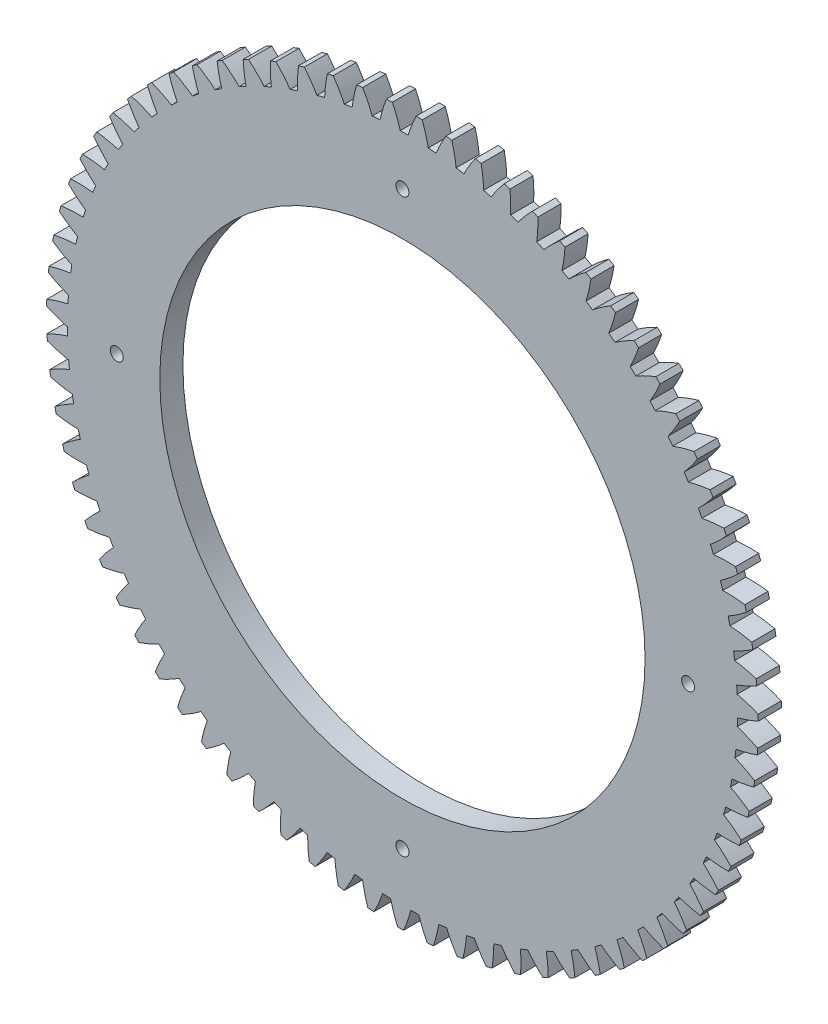
from build123d import *

# Parameters (mm, degrees)
SKETCH1_R           = 1.7859375
SKETCH1_R_2         = 66.675
BOSS_EXTRUDE1_DEPTH = 6.35


with BuildPart() as part:
    # Sketch1 → Boss-Extrude1 (new body)
    with BuildSketch(Plane.XY):
        with BuildLine():
            ThreePointArc((-97.77464665, 1.732793271), (-94.965729412, 0.569506405), (-92.073002114, -0.366111658))
            ThreePointArc((-92.073002114, -0.366111658), (-92.062340419, -1.448182518), (-92.038962327, -2.530053343))
            ThreePointArc((-92.038962327, -2.530053343), (-94.90083027, -3.556193809), (-97.671768724, -4.807254344))
            ThreePointArc((-97.671768724, -4.807254344), (-97.627726916, -5.631255378), (-97.576733606, -6.454855443))
            ThreePointArc((-97.576733606, -6.454855443), (-94.6803263, -7.379018362), (-91.719453703, -8.069297899))
            ThreePointArc((-91.719453703, -8.069297899), (-91.618284044, -9.146681636), (-91.504459324, -10.22280196))
            ThreePointArc((-91.504459324, -10.22280196), (-94.270425073, -11.484818544), (-96.926959408, -12.963357588))
            ThreePointArc((-96.926959408, -12.963357588), (-96.814121432, -13.780783411), (-96.694389885, -14.597227984))
            ThreePointArc((-96.694389885, -14.597227984), (-93.730808727, -15.275784617), (-90.722559224, -15.715883813))
            ThreePointArc((-90.722559224, -15.715883813), (-90.531591233, -16.781023355), (-90.328118285, -17.843844966))
            ThreePointArc((-90.328118285, -17.843844966), (-92.978780576, -19.332885529), (-95.502277113, -21.028532192))
            ThreePointArc((-95.502277113, -21.028532192), (-95.321434446, -21.833649149), (-95.133804493, -22.637211459))
            ThreePointArc((-95.133804493, -22.637211459), (-92.123836877, -23.065402218), (-89.089311176, -23.252234094))
            ThreePointArc((-89.089311176, -23.252234094), (-88.809884357, -24.297658252), (-88.518190397, -25.339726221))
            ThreePointArc((-88.518190397, -25.339726221), (-91.03495674, -27.045346212), (-93.407714963, -28.946206752))
            ThreePointArc((-93.407714963, -28.946206752), (-93.160136086, -29.733367526), (-92.905923817, -30.51841116))
            ThreePointArc((-92.905923817, -30.51841116), (-89.870682501, -30.693232595), (-86.83116562, -30.625486659))
            ThreePointArc((-86.83116562, -30.625486659), (-86.465239952, -31.643862534), (-86.087371004, -32.657867503))
            ThreePointArc((-86.087371004, -32.657867503), (-88.45258809, -34.568103224), (-90.657964806, -36.660844469))
            ThreePointArc((-90.657964806, -36.660844469), (-90.345386307, -37.424527694), (-90.026374838, -38.185546135))
            ThreePointArc((-90.026374838, -38.185546135), (-86.98714986, -38.105771999), (-83.963961826, -37.78392344))
            ThreePointArc((-83.963961826, -37.78392344), (-83.514104014, -38.768107857), (-83.052710556, -39.746937308))
            ThreePointArc((-83.052710556, -39.746937308), (-85.249788088, -41.848389829), (-87.272314163, -44.118332704))
            ThreePointArc((-87.272314163, -44.118332704), (-86.896928556, -44.853181689), (-86.515355523, -45.584836939))
            ThreePointArc((-86.515355523, -45.584836939), (-83.493464862, -45.251026791), (-80.507811168, -44.677333146))
            ThreePointArc((-80.507811168, -44.677333146), (-79.977176641, -45.620422758), (-79.435495017, -46.557210907))
            ThreePointArc((-79.435495017, -46.557210907), (-81.449022074, -48.835140048), (-83.274510942, -51.266362533))
            ThreePointArc((-83.274510942, -51.266362533), (-82.838951286, -51.967222841), (-82.39749315, -52.664382865))
            ThreePointArc((-82.39749315, -52.664382865), (-79.414133199, -52.078878143), (-76.48695606, -51.25736346))
            ThreePointArc((-76.48695606, -51.25736346), (-75.879266838, -52.152743171), (-75.261096556, -53.040919122))
            ThreePointArc((-75.261096556, -53.040919122), (-77.076949692, -55.479346847), (-78.692596859, -58.054795664))
            ThreePointArc((-78.692596859, -58.054795664), (-78.199918293, -58.716751264), (-77.701671566, -59.374525985))
            ThreePointArc((-77.701671566, -59.374525985), (-74.77776845, -58.541433583), (-71.92959991, -57.477860198))
            ThreePointArc((-71.92959991, -57.477860198), (-71.249118496, -58.319249563), (-70.558795576, -59.1525834))
            ThreePointArc((-70.558795576, -59.1525834), (-72.164237887, -61.73440589), (-73.558710749, -64.436016116))
            ThreePointArc((-73.558710749, -64.436016116), (-73.01236906, -65.054423864), (-72.460828583, -65.668199465))
            ThreePointArc((-72.460828583, -65.668199465), (-69.616891383, -64.593362929), (-66.867709298, -63.295191044))
            ThreePointArc((-66.867709298, -63.295191044), (-66.119208781, -64.076688322), (-65.361575343, -64.849334806))
            ThreePointArc((-65.361575343, -64.849334806), (-66.745345803, -67.556442431), (-67.908863136, -70.365264212))
            ThreePointArc((-67.908863136, -70.365264212), (-67.312690517, -70.935786423), (-66.711724952, -71.501257709))
            ThreePointArc((-66.711724952, -71.501257709), (-63.967701843, -70.192216244), (-61.33678975, -68.668551603))
            ThreePointArc((-61.33678975, -68.668551603), (-60.525520323, -69.38467515), (-59.70589062, -70.091214723))
            ThreePointArc((-59.70589062, -70.091214723), (-60.858283075, -72.904619068), (-61.78268364, -75.800950537))
            ThreePointArc((-61.78268364, -75.800950537), (-61.140861814, -76.319585407), (-60.494686502, -76.832786003))
            ThreePointArc((-60.494686502, -76.832786003), (-57.869824835, -75.298721595), (-55.375636692, -73.560251611))
            ThreePointArc((-55.375636692, -73.560251611), (-54.507288827, -74.205978336), (-53.631411974, -74.841455129))
            ThreePointArc((-53.631411974, -74.841455129), (-54.544343218, -77.741422184), (-55.223143009, -80.704947656))
            ThreePointArc((-55.223143009, -80.704947656), (-54.540173895, -81.168057335), (-53.853321292, -81.625387508))
            ThreePointArc((-53.853321292, -81.625387508), (-51.366032585, -79.877060517), (-49.02606333, -77.935979306))
            ThreePointArc((-49.02606333, -77.935979306), (-48.106727864, -78.5067799), (-47.180747506, -79.066736501))
            ThreePointArc((-47.180747506, -79.066736501), (-47.847813983, -82.032925081), (-48.276251708, -85.042857555))
            ThreePointArc((-48.276251708, -85.042857555), (-47.556925843, -85.44719366), (-46.834213727, -85.845445567))
            ThreePointArc((-46.834213727, -85.845445567), (-44.501944523, -83.89511925), (-42.33260736, -81.765042104))
            ThreePointArc((-42.33260736, -81.765042104), (-41.368732769, -82.256912811), (-40.399143994, -82.737421525))
            ThreePointArc((-40.399143994, -82.737421525), (-40.815666712, -85.749025949), (-40.990737187, -88.78425291))
            ThreePointArc((-40.990737187, -88.78425291), (-40.240100126, -89.126979315), (-39.486597802, -89.463359505))
            ThreePointArc((-39.486597802, -89.463359505), (-37.325707295, -87.324714), (-35.342218564, -85.020581879))
            ThreePointArc((-35.342218564, -85.020581879), (-34.340565738, -85.430072579), (-33.334169514, -85.827762985))
            ThreePointArc((-33.334169514, -85.827762985), (-33.497226865, -88.86365901), (-33.417702097, -91.902890523))
            ThreePointArc((-33.417702097, -91.902890523), (-32.64101902, -92.181603248), (-31.862011765, -92.453752256))
            ThreePointArc((-31.862011765, -92.453752256), (-29.887657049, -90.141788625), (-28.103929499, -87.67976336))
            ThreePointArc((-28.103929499, -87.67976336), (-27.071524311, -88.00400177), (-26.035379785, -88.316084354))
            ThreePointArc((-26.035379785, -88.316084354), (-25.943828039, -91.354977352), (-25.610265837, -94.376895392))
            ThreePointArc((-25.610265837, -94.376895392), (-24.812984617, -94.589639466), (-24.013936609, -94.795648363))
            ThreePointArc((-24.013936609, -94.795648363), (-22.239966363, -92.326583369), (-20.66851156, -89.723934298))
            ThreePointArc((-20.66851156, -89.723934298), (-19.612595592, -89.96064612), (-18.553970573, -90.184931846))
            ThreePointArc((-18.553970573, -90.184931846), (-18.2084519, -93.205506167), (-17.623191963, -96.188914148))
            ThreePointArc((-17.623191963, -96.188914148), (-16.810904955, -96.334197327), (-15.997420941, -96.472621107))
            ThreePointArc((-15.997420941, -96.472621107), (-14.436278292, -93.863773467), (-13.088118864, -91.138756304))
            ThreePointArc((-13.088118864, -91.138756304), (-12.016098607, -91.286281173), (-10.942418589, -91.421196839))
            ThreePointArc((-10.942418589, -91.421196839), (-10.345356553, -94.402265323), (-9.51250406, -97.326236784))
            ThreePointArc((-9.51250406, -97.326236784), (-8.690908874, -97.403040009), (-7.868694859, -97.472907729))
            ThreePointArc((-7.868694859, -97.472907729), (-6.531330101, -94.742576635), (-5.415922417, -91.914305418))
            ThreePointArc((-5.415922417, -91.914305418), (-4.335317323, -91.971608553), (-3.254113401, -92.016207823))
            ThreePointArc((-3.254113401, -92.016207823), (-2.409695964, -94.936860416), (-1.335092776, -97.780885797))
            ThreePointArc((-1.335092776, -97.780885797), (-0.509952312, -97.788670349), (0.315224464, -97.789491938))
            ThreePointArc((0.315224464, -97.789491938), (1.419430677, -94.956828701), (2.294262834, -92.045141719))
            ThreePointArc((2.294262834, -92.045141719), (3.375873096, -92.01182118), (4.457017055, -91.965791222))
            ThreePointArc((4.457017055, -91.965791222), (5.542866911, -94.805541646), (6.851683225, -97.549672152))
            ThreePointArc((6.851683225, -97.549672152), (7.6745812, -97.488383428), (8.496932713, -97.420153123))
            ThreePointArc((8.496932713, -97.420153123), (9.360235169, -94.505026839), (9.988355479, -91.530347486))
            ThreePointArc((9.988355479, -91.530347486), (11.063384191, -91.406636993), (12.136884739, -91.270300673))
            ThreePointArc((12.136884739, -91.270300673), (13.456550558, -94.009230118), (14.990399591, -96.634217646))
            ThreePointArc((14.990399591, -96.634217646), (15.805283039, -96.504285542), (16.619041084, -96.36748193))
            ThreePointArc((16.619041084, -96.36748193), (17.235384337, -93.390340117), (17.612386988, -90.37353363))
            ThreePointArc((17.612386988, -90.37353363), (18.673293596, -90.160300922), (19.731620897, -89.934614542))
            ThreePointArc((19.731620897, -89.934614542), (21.275846171, -92.553511387), (23.023969075, -95.040943535))
            ThreePointArc((23.023969075, -95.040943535), (23.825122173, -94.843279432), (24.624578823, -94.63886209))
            ThreePointArc((24.624578823, -94.63886209), (24.989639667, -91.620587259), (25.112880256, -88.582814368))
            ThreePointArc((25.112880256, -88.582814368), (26.152223262, -88.281555121), (27.187953911, -87.968101709))
            ThreePointArc((27.187953911, -87.968101709), (28.945907009, -90.448596273), (30.896041958, -92.781025492))
            ThreePointArc((30.896041958, -92.781025492), (31.677845194, -92.517015861), (32.457392835, -92.246418632))
            ThreePointArc((32.457392835, -92.246418632), (32.56861063, -89.208181811), (32.437224713, -86.17075031))
            ThreePointArc((32.437224713, -86.17075031), (33.447713873, -85.78357764), (34.453582963, -85.384555847))
            ThreePointArc((34.453582963, -85.384555847), (36.412933108, -87.709249243), (38.551401305, -89.870315218))
            ThreePointArc((38.551401305, -89.870315218), (39.308370891, -89.541811898), (40.062541556, -89.206932825))
            ThreePointArc((40.062541556, -89.206932825), (39.91913619, -86.170045063), (39.534045345, -83.154260353))
            ThreePointArc((39.534045345, -83.154260353), (40.508592803, -82.683889998), (41.477544885, -82.202098674))
            ThreePointArc((41.477544885, -82.202098674), (43.624548643, -84.354684849), (45.936350272, -86.329229255))
            ThreePointArc((45.936350272, -86.329229255), (46.663176609, -85.938536459), (47.386680333, -85.54172448))
            ThreePointArc((47.386680333, -85.54172448), (46.989657692, -82.527487362), (46.353563054, -79.554503005))
            ThreePointArc((46.353563054, -79.554503005), (47.28533306, -79.004234276), (48.210571632, -78.443052841))
            ThreePointArc((48.210571632, -78.443052841), (50.530169314, -80.40843295), (52.999088746, -82.182605776))
            ThreePointArc((52.999088746, -82.182605776), (53.690673671, -81.732463934), (54.378435595, -81.276502399))
            ThreePointArc((54.378435595, -81.276502399), (53.730580507, -78.306058634), (52.847943822, -75.396727978))
            ThreePointArc((52.847943822, -75.396727978), (53.730400679, -74.770420615), (54.605435857, -74.133785354))
            ThreePointArc((54.605435857, -74.133785354), (57.081357153, -75.898173667), (59.690076693, -77.459530365))
            ThreePointArc((59.690076693, -77.459530365), (60.341569234, -76.9530969), (60.988765202, -76.441184051))
            ThreePointArc((60.988765202, -76.441184051), (60.094621904, -73.535369167), (58.971634237, -70.710099078))
            ThreePointArc((58.971634237, -70.710099078), (59.798588144, -70.012146176), (60.617282185, -69.304522628))
            ThreePointArc((60.617282185, -69.304522628), (63.232160285, -70.855543228), (65.962381639, -72.193132003))
            ThreePointArc((65.962381639, -72.193132003), (66.569212043, -71.633959181), (67.171302441, -71.06968572))
            ThreePointArc((67.171302441, -71.06968572), (66.037142708, -68.24888192), (64.681681008, -65.527489637))
            ThreePointArc((64.681681008, -65.527489637), (65.447331478, -64.762786835), (66.203941831, -63.98913847))
            ThreePointArc((66.203941831, -63.98913847), (68.939435244, -65.315912063), (71.772007872, -66.420350692))
            ThreePointArc((71.772007872, -66.420350692), (72.329919661, -65.812360707), (72.882681256, -65.199684607))
            ThreePointArc((72.882681256, -65.199684607), (71.516460402, -62.483677804), (69.93803226, -59.885251938))
            ThreePointArc((69.93803226, -59.885251938), (70.637008805, -59.059163076), (71.326228392, -58.224916483))
            ThreePointArc((71.326228392, -58.224916483), (74.163149598, -59.318136704), (77.078205038, -60.181678343))
            ThreePointArc((77.078205038, -60.181678343), (77.583284861, -59.52913581), (78.082840429, -58.872354553))
            ThreePointArc((78.082840429, -58.872354553), (76.494141512, -56.280195582), (74.703818467, -53.822962224))
            ThreePointArc((74.703818467, -53.822962224), (75.331218268, -52.941281722), (75.94821271, -52.052288541))
            ThreePointArc((75.94821271, -52.052288541), (78.866662744, -52.904287237), (81.843753976, -53.520874761))
            ThreePointArc((81.843753976, -53.520874761), (82.292459061, -52.828356796), (82.735304578, -52.13207723))
            ThreePointArc((82.735304578, -52.13207723), (80.935271179, -49.681948225), (78.945611062, -47.383143102))
            ThreePointArc((78.945611062, -47.383143102), (79.49703336, -46.452055315), (80.037474884, -45.514551194))
            ThreePointArc((80.037474884, -45.514551194), (83.016982916, -46.119352206), (86.035227784, -46.484660697))
            ThreePointArc((86.035227784, -46.484660697), (86.424410788, -45.757024816), (86.807440011, -45.026130843))
            ThreePointArc((86.807440011, -45.026130843), (84.808698072, -42.735217698), (82.633656917, -40.610965276))
            ThreePointArc((82.633656917, -40.610965276), (83.105233882, -39.637001116), (83.565331678, -38.657561973))
            ThreePointArc((83.565331678, -38.657561973), (86.584998601, -39.010923056), (89.623226286, -39.122390138))
            ThreePointArc((89.623226286, -39.122390138), (89.950157369, -38.364740184), (90.270683623, -37.6043585))
            ThreePointArc((90.270683623, -37.6043585), (88.087252882, -35.488730324), (85.742087041, -33.553930707))
            ThreePointArc((85.742087041, -33.553930707), (86.130510899, -32.543921834), (86.507037712, -31.52941773))
            ThreePointArc((86.507037712, -31.52941773), (89.545682731, -31.62886031), (92.58258225, -31.485704121))
            ThreePointArc((92.58258225, -31.485704121), (92.844968225, -30.703354464), (93.100743249, -29.9188186))
            ThreePointArc((93.100743249, -29.9188186), (90.747938904, -27.993315006), (88.249098031, -26.261539423))
            ThreePointArc((88.249098031, -26.261539423), (88.551644267, -25.222570322), (88.841959032, -24.180117275))
            ThreePointArc((88.841959032, -24.180117275), (91.878268236, -24.024943835), (94.892537919, -23.628168512))
            ThreePointArc((94.892537919, -23.628168512), (95.088538338, -22.826606773), (95.277768054, -22.023419684))
            ThreePointArc((95.277768054, -22.023419684), (92.772093337, -20.301546696), (90.137105004, -18.784942309))
            ThreePointArc((90.137105004, -18.784942309), (90.351651475, -17.724300602), (90.553717842, -16.661210671))
            ThreePointArc((90.553717842, -16.661210671), (93.566393704, -16.25250964), (96.536890616, -15.604898278))
            ThreePointArc((96.536890616, -15.604898278), (96.665130675, -14.789746837), (96.786487773, -13.973542303))
            ThreePointArc((96.786487773, -13.973542303), (94.145518192, -12.467377622), (91.39286495, -11.176582321))
            ThreePointArc((91.39286495, -11.176582321), (91.517906765, -10.101707648), (91.630307385, -9.025437645))
            ThreePointArc((91.630307385, -9.025437645), (94.598218147, -8.366075767), (97.504106386, -7.472170895))
            ThreePointArc((97.504106386, -7.472170895), (97.563686575, -6.649147452), (97.616319822, -5.825650563))
            ThreePointArc((97.616319822, -5.825650563), (94.85857988, -4.545758852), (92.007569613, -3.489826639))
            ThreePointArc((92.007569613, -3.489826639), (92.042229695, -2.408258473), (92.064176157, -1.326357659))
            ThreePointArc((92.064176157, -1.326357659), (94.966504059, -0.420959885), (97.787400907, 0.712968399))
            ThreePointArc((97.787400907, 0.712968399), (97.777903313, 1.538090924), (97.761443524, 2.36310393))
            ThreePointArc((97.761443524, 2.36310393), (94.906276786, 3.40774515), (91.976907283, 4.22140767))
            ThreePointArc((91.976907283, 4.22140767), (91.920942516, 5.302082905), (91.852280882, 6.382025773))
            ThreePointArc((91.852280882, 6.382025773), (94.668668178, 7.527108729), (97.38478707, 8.893106731))
            ThreePointArc((97.38478707, 8.893106731), (97.306278313, 9.714540697), (97.220840941, 10.535282947))
            ThreePointArc((97.220840941, 10.535282947), (94.28827435, 11.337346268), (91.301093034, 11.903031837))
            ThreePointArc((91.301093034, 11.903031837), (91.15489597, 12.97523398), (90.996107852, 14.045643879))
            ThreePointArc((90.996107852, 14.045643879), (93.706799609, 15.422380084), (96.299088923, 17.01086631))
            ThreePointArc((96.299088923, 17.01086631), (96.152119684, 17.822849948), (95.998304012, 18.633564524))
            ThreePointArc((95.998304012, 18.633564524), (93.008907416, 19.187424048), (89.984867217, 19.501164788))
            ThreePointArc((89.984867217, 19.501164788), (89.749463323, 20.557373113), (89.501662506, 21.610741886))
            ThreePointArc((89.501662506, 21.610741886), (92.087645169, 23.209474523), (94.537921858, 25.009306883))
            ThreePointArc((94.537921858, 25.009306883), (94.323523021, 25.806144711), (94.102407955, 26.601145034))
            ThreePointArc((94.102407955, 26.601145034), (91.077149823, 26.902915835), (88.03746221, 26.96251108))
            ThreePointArc((88.03746221, 26.96251108), (87.714502677, 27.995317043), (87.379427304, 29.024256065))
            ThreePointArc((87.379427304, 29.024256065), (89.822562063, 30.833771174), (92.113639197, 32.832325138))
            ThreePointArc((92.113639197, 32.832325138), (91.833314616, 33.608427911), (91.546451119, 34.382137624))
            ThreePointArc((91.546451119, 34.382137624), (88.506551463, 34.429702996), (85.472537661, 34.234734728))
            ThreePointArc((85.472537661, 34.234734728), (85.064287816, 35.236893938), (84.644288202, 36.234185943))
            ThreePointArc((84.644288202, 36.234185943), (86.927438221, 38.241791075), (89.04324554, 40.425048222))
            ThreePointArc((89.04324554, 40.425048222), (88.69896149, 41.174972137), (88.348361704, 41.921964222))
            ThreePointArc((88.348361704, 41.921964222), (85.315143237, 41.714990529), (82.308084672, 41.266826311))
            ThreePointArc((82.308084672, 41.266826311), (81.817408096, 42.231309341), (81.315430235, 43.18995904))
            ThreePointArc((81.315430235, 43.18995904), (83.422580858, 45.381572288), (85.348277493, 47.734218638))
            ThreePointArc((85.348277493, 47.734218638), (84.94244888, 48.452703518), (84.53057201, 49.167738362))
            ThreePointArc((84.53057201, 49.167738362), (81.525310579, 48.707677376), (78.566299607, 48.009460757))
            ThreePointArc((78.566299607, 48.009460757), (77.996638043, 48.929502451), (77.41620295, 49.842785606))
            ThreePointArc((77.41620295, 49.842785606), (79.332574029, 52.203034378), (81.054652602, 54.708567808))
            ThreePointArc((81.054652602, 54.708567808), (80.590126022, 55.390573997), (80.119861088, 56.068636145))
            ThreePointArc((80.119861088, 56.068636145), (77.163636444, 55.358714862), (74.273428401, 54.41534333))
            ThreePointArc((74.273428401, 54.41534333), (73.628777615, 55.284490258), (72.973956624, 56.146000843))
            ThreePointArc((72.973956624, 56.146000843), (74.686106194, 58.658329689), (76.192487561, 61.299175682))
            ThreePointArc((76.192487561, 61.299175682), (75.672521334, 61.939919397), (75.147166907, 62.57625273))
            ThreePointArc((75.147166907, 62.57625273), (72.260714841, 61.621450738), (69.459582459, 60.439541368))
            ThreePointArc((69.459582459, 60.439541368), (68.744464214, 61.251697087), (68.019850425, 62.055392226))
            ThreePointArc((68.019850425, 62.055392226), (69.515768985, 64.702178964), (70.795886964, 67.459813882))
            ThreePointArc((70.795886964, 67.459813882), (70.22412828, 68.054800766), (69.647369344, 68.644941864))
            ThreePointArc((69.647369344, 68.644941864), (66.850936242, 67.451956413), (64.158527453, 66.039799448))
            ThreePointArc((64.158527453, 66.039799448), (63.377957789, 66.789267271), (62.588633847, 67.529509618))
            ThreePointArc((62.588633847, 67.529509618), (63.857828605, 70.292188942), (64.902704086, 73.147269958))
            ThreePointArc((64.902704086, 73.147269958), (64.283163421, 73.692326606), (63.659045526, 74.232136051))
            ThreePointArc((63.659045526, 74.232136051), (60.972246358, 72.809335077), (58.407446475, 71.176835785))
            ThreePointArc((58.407446475, 71.176835785), (57.566900528, 71.858358733), (56.718402973, 72.52995602))
            ThreePointArc((56.718402973, 72.52995602), (57.751971438, 75.389149719), (58.554275372, 78.321650491))
            ThreePointArc((58.554275372, 78.321650491), (57.891298359, 78.812953722), (57.224199242, 79.29864514))
            ThreePointArc((57.224199242, 79.29864514), (54.665879975, 77.656008569), (52.246679226, 75.814617759))
            ThreePointArc((52.246679226, 75.814617759), (51.352052821, 76.423415438), (50.450333254, 77.021656894))
            ThreePointArc((50.450333254, 77.021656894), (51.241025686, 79.957309778), (51.795130488, 82.94666092))
            ThreePointArc((51.795130488, 82.94666092), (51.093367433, 83.380764594), (50.387966317, 83.808931209))
            ThreePointArc((50.387966317, 83.808931209), (47.97607172, 81.957980957), (45.719439061, 79.920614663))
            ThreePointArc((45.719439061, 79.920614663), (44.77700736, 80.452416794), (43.828390695, 80.973106185))
            ThreePointArc((43.828390695, 80.973106185), (44.370660956, 83.964626758), (44.672679978, 86.98986012))
            ThreePointArc((44.672679978, 86.98986012), (43.937053246, 87.363719312), (43.198298011, 87.731357843))
            ThreePointArc((43.198298011, 87.731357843), (40.949745794, 85.685076996), (38.87150988, 83.466025877))
            ThreePointArc((38.87150988, 83.466025877), (37.887883364, 83.917102251), (36.899023467, 84.356587314))
            ThreePointArc((36.899023467, 84.356587314), (37.18906792, 87.38299221), (37.236882715, 90.422887953))
            ThreePointArc((37.236882715, 90.422887953), (36.472552198, 90.73388031), (35.705624683, 91.038412036))
            ThreePointArc((35.705624683, 91.038412036), (33.636186823, 88.811153783), (31.750924987, 86.42598289))
            ThreePointArc((31.750924987, 86.42598289), (30.73300309, 86.793169531), (29.710836101, 87.148367594))
            ThreePointArc((29.710836101, 87.148367594), (29.746620292, 90.188428756), (29.539895474, 93.221664195))
            ThreePointArc((29.539895474, 93.221664195), (28.752222402, 93.46760833), (27.962502052, 93.706897179))
            ThreePointArc((27.962502052, 93.706897179), (26.086694169, 91.314284138), (24.407630168, 88.779723731))
            ThreePointArc((24.407630168, 88.779723731), (23.36255288, 89.060445087), (22.314248566, 89.328864691))
            ThreePointArc((22.314248566, 89.328864691), (22.095521496, 92.361258275), (21.635707091, 95.366557444))
            ThreePointArc((21.635707091, 95.366557444), (20.830216425, 95.545728234), (20.02324256, 95.718095768))
            ThreePointArc((20.02324256, 95.718095768), (18.354222099, 93.176910399), (16.89313336, 90.510738597))
            ThreePointArc((16.89313336, 90.510738597), (15.828231148, 90.70302561), (14.761142611, 90.882783985))
            ThreePointArc((14.761142611, 90.882783985), (14.289438492, 93.886239929), (13.579759768, 96.842522812))
            ThreePointArc((13.579759768, 96.842522812), (12.762101446, 96.953663503), (11.943534409, 97.057900687))
            ThreePointArc((11.943534409, 97.057900687), (10.493008348, 94.385967581), (9.26014336, 91.606885664))
            ThreePointArc((9.26014336, 91.606885664), (8.182885746, 91.709389579), (7.104497846, 91.799225849))
            ThreePointArc((7.104497846, 91.799225849), (6.383125344, 94.752677066), (5.428560188, 97.639207464))
            ThreePointArc((5.428560188, 97.639207464), (4.604469495, 97.681538484), (3.780050945, 97.71691417))
            ThreePointArc((3.780050945, 97.71691417), (2.558193683, 94.932975016), (1.562200107, 92.060476248))
            ThreePointArc((1.562200107, 92.060476248), (0.480143281, 92.072478073), (-0.601979866, 92.071762101))
            ThreePointArc((-0.601979866, 92.071762101), (-1.567960842, 94.954492254), (-2.760716842, 97.75102323))
            ThreePointArc((-2.760716842, 97.75102323), (-3.585459501, 97.724247657), (-4.409946861, 97.690513709))
            ThreePointArc((-4.409946861, 97.690513709), (-5.394564873, 94.814095841), (-6.146700858, 91.868328736))
            ThreePointArc((-6.146700858, 91.868328736), (-7.225967045, 91.789744288), (-8.304235122, 91.698481095))
            ThreePointArc((-8.304235122, 91.698481095), (-9.508048909, 94.490269903), (-10.930629427, 97.177185802))
            ThreePointArc((-10.930629427, 97.177185802), (-11.750239076, 97.081491447), (-12.569012058, 96.978884485))
            ThreePointArc((-12.569012058, 96.978884485), (-13.309484432, 94.030163908), (-13.812487132, 91.031790905))
            ThreePointArc((-13.812487132, 91.031790905), (-14.881392403, 90.863171397), (-15.948242136, 90.68200113))
            ThreePointArc((-15.948242136, 90.68200113), (-17.381444844, 93.3632662), (-19.0238715, 95.921720237))
            ThreePointArc((-19.0238715, 95.921720237), (-19.832599165, 95.757778328), (-20.639914666, 95.587018065))
            ThreePointArc((-20.639914666, 95.587018065), (-21.131047521, 92.586677935), (-21.381388733, 89.556730467))
            ThreePointArc((-21.381388733, 89.556730467), (-22.432435486, 89.299258643), (-23.48038369, 89.029452081))
            ThreePointArc((-23.48038369, 89.029452081), (-25.132922433, 91.581386266), (-26.983674783, 93.993432724))
            ThreePointArc((-26.983674783, 93.993432724), (-27.775847821, 93.762393196), (-28.566043102, 93.524677393))
            ThreePointArc((-28.566043102, 93.524677393), (-28.804391494, 90.49376294), (-28.800315254, 87.453493912))
            ThreePointArc((-28.800315254, 87.453493912), (-29.826131152, 87.108975752), (-30.847827222, 86.752425394))
            ThreePointArc((-30.847827222, 86.752425394), (-32.708110629, 89.157128708), (-34.754206976, 91.405848814))
            ThreePointArc((-34.754206976, 91.405848814), (-35.524268862, 91.109332243), (-36.291801271, 90.806328306))
            ThreePointArc((-36.291801271, 90.806328306), (-36.275693357, 87.766099217), (-36.017228258, 84.736833932))
            ThreePointArc((-36.017228258, 84.736833932), (-37.010617938, 84.307685984), (-37.998895411, 83.866892774))
            ThreePointArc((-37.998895411, 83.866892774), (-40.053874929, 86.107497952), (-42.280963377, 88.177118551))
            ThreePointArc((-42.280963377, 88.177118551), (-43.02351268, 87.817204787), (-43.76299853, 87.451038071))
            ThreePointArc((-43.76299853, 87.451038071), (-43.492547294, 84.422819369), (-42.981506283, 81.425805945))
            ThreePointArc((-42.981506283, 81.425805945), (-43.935501831, 80.915038373), (-44.883428651, 80.39309416))
            ThreePointArc((-44.883428651, 80.39309416), (-47.118690075, 82.453884966), (-49.511149199, 84.329889156))
            ThreePointArc((-49.511149199, 84.329889156), (-50.22097747, 83.909102736), (-50.927229797, 83.482341637))
            ThreePointArc((-50.927229797, 83.482341637), (-50.404332262, 80.4873741), (-49.644299924, 77.543634434))
            ThreePointArc((-49.644299924, 77.543634434), (-50.552209746, 76.954829906), (-51.453136887, 76.355395753))
            ThreePointArc((-51.453136887, 76.355395753), (-53.853001465, 78.22191722), (-56.394049883, 79.891146179))
            ThreePointArc((-56.394049883, 79.891146179), (-57.066178186, 79.412438618), (-57.734243139, 78.928076558))
            ThreePointArc((-57.734243139, 78.928076558), (-56.962567055, 75.987367732), (-55.95887447, 73.117550042))
            ThreePointArc((-55.95887447, 73.117550042), (-56.814330232, 72.454838599), (-57.661938338, 71.782119105))
            ThreePointArc((-57.661938338, 71.782119105), (-60.209572744, 73.441278926), (-62.881386826, 74.892024214))
            ThreePointArc((-62.881386826, 74.892024214), (-63.511100664, 74.3587533), (-64.136292247, 73.820187733))
            ThreePointArc((-64.136292247, 73.820187733), (-63.121250367, 70.954364577), (-61.880937718, 68.178598572))
            ThreePointArc((-61.880937718, 68.178598572), (-62.677939012, 67.446628658), (-63.466282721, 66.705342468))
            ThreePointArc((-63.466282721, 66.705342468), (-66.14381713, 68.145502829), (-68.927656021, 69.367588508))
            ThreePointArc((-68.927656021, 69.367588508), (-69.510538404, 68.783494755), (-70.088471346, 68.194503329))
            ThreePointArc((-70.088471346, 68.194503329), (-68.83718346, 65.423667534), (-67.36895065, 62.761423219))
            ThreePointArc((-67.36895065, 62.761423219), (-68.101907084, 61.965329077), (-68.825456731, 61.160675781))
            ThreePointArc((-68.825456731, 61.160675781), (-71.614110163, 62.371734992), (-74.490447233, 63.35658901))
            ThreePointArc((-74.490447233, 63.35658901), (-75.02240966, 62.725769415), (-75.549030178, 62.090483483))
            ThreePointArc((-75.549030178, 62.090483483), (-74.070273171, 59.43407047), (-72.384418797, 56.904021576))
            ThreePointArc((-72.384418797, 56.904021576), (-73.048189209, 56.049387234), (-73.701869613, 55.187010897))
            ThreePointArc((-73.701869613, 55.187010897), (-76.582081668, 56.160474248), (-79.530741479, 56.901188562))
            ThreePointArc((-79.530741479, 56.901188562), (-80.008052616, 56.228067871), (-80.479666845, 55.550943507))
            ThreePointArc((-80.479666845, 55.550943507), (-78.783813135, 53.027586106), (-76.892162255, 50.647479107))
            ThreePointArc((-76.892162255, 50.647479107), (-77.482090772, 49.740299212), (-78.061316834, 48.826248783))
            ThreePointArc((-78.061316834, 48.826248783), (-81.012884894, 49.555288128), (-84.013184717, 50.046667159))
            ThreePointArc((-84.013184717, 50.046667159), (-84.432496569, 49.335966831), (-84.845796473, 48.621753576))
            ThreePointArc((-84.845796473, 48.621753576), (-82.944741256, 46.249151325), (-80.860562441, 44.035680963))
            ThreePointArc((-80.860562441, 44.035680963), (-81.372511139, 43.082318729), (-81.873220005, 42.123005616))
            ThreePointArc((-81.873220005, 42.123005616), (-84.87544094, 42.602507268), (-87.906335827, 42.841104344))
            ThreePointArc((-87.906335827, 42.841104344), (-88.264707223, 42.097809431), (-88.616793801, 41.351516978))
            ThreePointArc((-88.616793801, 41.351516978), (-86.523871613, 39.146311978), (-84.26178388, 37.115004156))
            ThreePointArc((-84.26178388, 37.115004156), (-84.692161806, 36.122146735), (-85.110841363, 35.12429983))
            ThreePointArc((-85.110841363, 35.12429983), (-88.142656752, 35.350900429), (-91.182887152, 35.335041964))
            ThreePointArc((-91.182887152, 35.335041964), (-91.477804373, 34.564366146), (-91.766207992, 33.791229199))
            ThreePointArc((-91.766207992, 33.791229199), (-89.496099178, 31.768889378), (-87.071969447, 29.933992262))
            ThreePointArc((-87.071969447, 29.933992262), (-87.417757809, 28.908603835), (-87.751471322, 27.879222317))
            ThreePointArc((-87.751471322, 27.879222317), (-90.791615156, 27.851332423), (-93.819856038, 27.581129653))
            ThreePointArc((-93.819856038, 27.581129653), (-94.049250453, 26.788478666), (-94.271948167, 25.993920227))
            ThreePointArc((-94.271948167, 25.993920227), (-91.840575909, 24.168630846), (-89.27140771, 22.54301492))
            ThreePointArc((-89.27140771, 22.54301492), (-89.530181051, 21.49228785), (-89.776587758, 20.438592091))
            ThreePointArc((-89.776587758, 20.438592091), (-92.803735614, 20.156407331), (-95.798746044, 19.633755534))
            ThreePointArc((-95.798746044, 19.633755534), (-95.961008615, 18.824689256), (-96.116438361, 18.01428258))
            ThreePointArc((-96.116438361, 18.01428258), (-93.540856989, 16.398846733), (-90.844671188, 14.993914525))
            ThreePointArc((-90.844671188, 14.993914525), (-91.014614401, 13.925218908), (-91.171985935, 12.854599826))
            ThreePointArc((-91.171985935, 12.854599826), (-94.164904545, 12.320099524), (-97.105676678, 11.548664727))
            ThreePointArc((-97.105676678, 11.548664727), (-97.19966925, 10.728858176), (-97.286740798, 9.908287685))
            ThreePointArc((-97.286740798, 9.908287685), (-94.585016165, 8.514036494), (-91.780724571, 7.339642593))
            ThreePointArc((-91.780724571, 7.339642593), (-91.860645624, 6.26047456), (-91.927878139, 5.18044178))
            ThreePointArc((-91.927878139, 5.18044178), (-94.865574329, 4.397375071), (-97.73148076, 3.382568335))
            ThreePointArc((-97.73148076, 3.382568335), (-97.756544042, 2.557771865), (-97.77464665, 1.732793271))
        make_face()
        with Locations((0, 78.5)):
            Circle(SKETCH1_R, mode=Mode.SUBTRACT)
        with Locations((78.5, 0)):
            Circle(SKETCH1_R, mode=Mode.SUBTRACT)
        with Locations((0, -78.5)):
            Circle(SKETCH1_R, mode=Mode.SUBTRACT)
        with Locations((-78.5, 0)):
            Circle(SKETCH1_R, mode=Mode.SUBTRACT)
        Circle(SKETCH1_R_2, mode=Mode.SUBTRACT)
    extrude(amount=BOSS_EXTRUDE1_DEPTH)


solid = part.part
